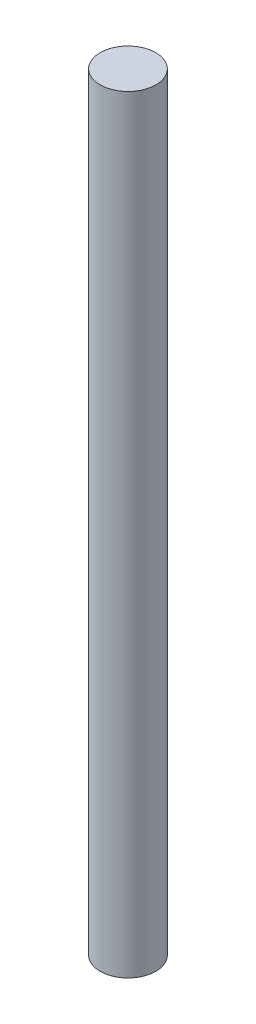
from build123d import *

# Parameters (mm, degrees)
SKETCH1_R           = 12.446
BOSS_EXTRUDE1_DEPTH = 342.9


with BuildPart() as part:
    # Sketch1 → Boss-Extrude1 (new body)
    with BuildSketch(Plane(origin=(0, 0, 0), x_dir=(1, 0, 0), z_dir=(0, 1, 0))):
        Circle(SKETCH1_R)
    extrude(amount=BOSS_EXTRUDE1_DEPTH)


solid = part.part
